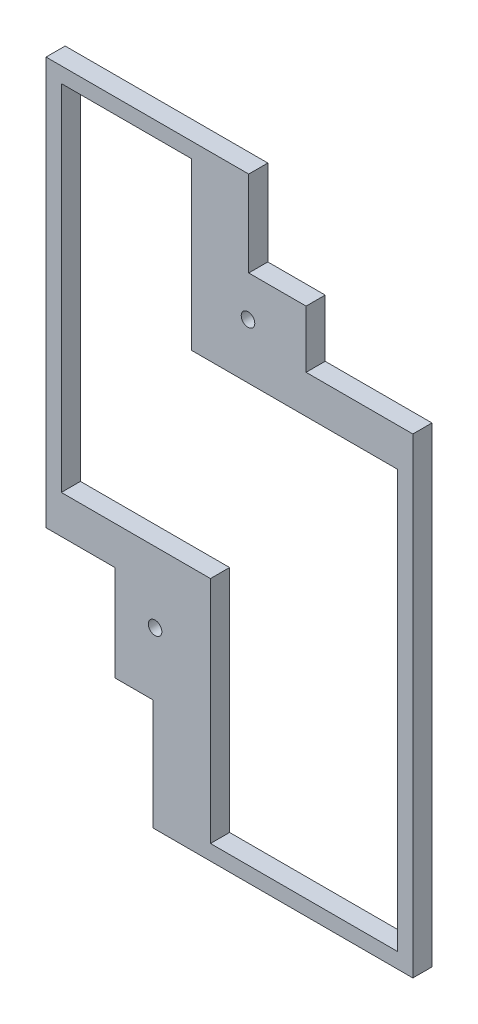
from build123d import *

# Parameters (mm, degrees)
BOSS_EXTRUDE1_DEPTH   = 6.35
F_8_CLEARANCE_HOLE1_D = 4.4958


with BuildPart() as part:
    # Sketch1 → Boss-Extrude1 (new body)
    with BuildSketch(Plane.XY):
        Polygon((40.64, 122.682), (40.64, 94.234), (59.69, 94.234), (59.69, 75.184), (95.1484, 75.184), (95.1484, -81.28), (8.89, -81.28), (8.89, -44.45), (-3.81, -44.45), (-3.81, -12.7), (-26.67, -12.7), (-26.67, 122.682), align=None)
        Polygon((90.0684, 62.484), (27.94, 62.484), (21.59, 62.484), (21.59, 117.602), (-21.59, 117.602), (-21.59, 0), (21.59, 0), (27.94, 0), (27.94, -76.2), (90.0684, -76.2), align=None, mode=Mode.SUBTRACT)
    extrude(amount=BOSS_EXTRUDE1_DEPTH)

    # #8 Clearance Hole1 (through all)
    with Locations(Plane.XY.offset(6.35)):
        with Locations((9.538335251, -23.376368086), (40.402766773, 80.728472273)):
            Hole(F_8_CLEARANCE_HOLE1_D / 2)


solid = part.part
